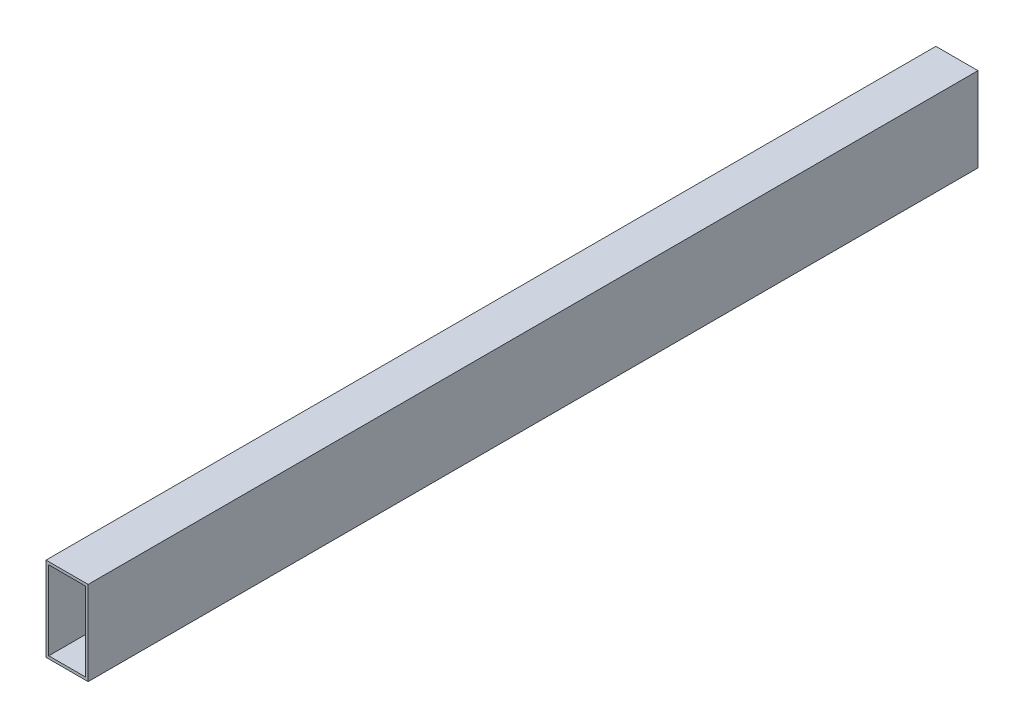
from build123d import *

# Parameters (mm, degrees)
SKETCH1_W           = 25.4
SKETCH1_H           = 50.8
BOSS_EXTRUDE1_DEPTH = 536.575
SKETCH2_W           = 22.098
SKETCH2_H           = 47.498
CUT_EXTRUDE1_DEPTH  = 540.602537757


with BuildPart() as part:
    # Sketch1 → Boss-Extrude1 (new body)
    with BuildSketch(Plane.XY):
        with Locations((-35.737209302, -4.799418605)):
            Rectangle(SKETCH1_W, SKETCH1_H)
    extrude(amount=BOSS_EXTRUDE1_DEPTH)

    # Sketch2 → Cut-Extrude1 (cut, through all)
    with BuildSketch(Plane.XY.offset(536.575)):
        with Locations((-35.737209302, -4.799418605)):
            Rectangle(SKETCH2_W, SKETCH2_H)
    extrude(amount=-CUT_EXTRUDE1_DEPTH, mode=Mode.SUBTRACT)


solid = part.part
